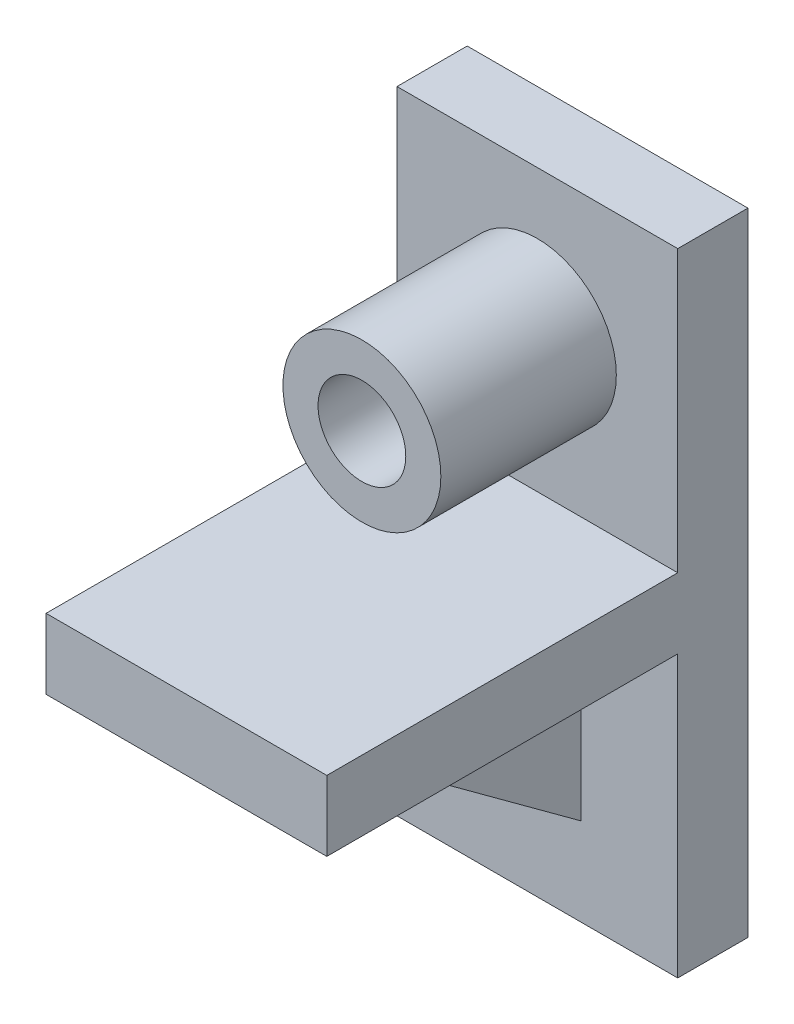
from build123d import *

# Parameters (mm, degrees)
SKETCH2_W           = 32
SKETCH2_H           = 72
BOSS_EXTRUDE1_DEPTH = 8
SKETCH3_R           = 9
SKETCH3_R_2         = 5
SKETCH3_W           = 32
SKETCH3_H           = 8
BOSS_EXTRUDE2_DEPTH = 20
SKETCH4_W           = 32
SKETCH4_H           = 8
BOSS_EXTRUDE3_DEPTH = 20
RIB1_REACH          = 80.09
SKETCH5_WALL_W      = 195.381659614
SKETCH5_WALL_H      = 10


with BuildPart() as part:
    # Sketch2 → Boss-Extrude1 (new body)
    with BuildSketch(Plane.XY):
        with Locations((-4.753138075, -23.481171548)):
            Rectangle(SKETCH2_W, SKETCH2_H)
    extrude(amount=BOSS_EXTRUDE1_DEPTH)

    # Sketch3 → Boss-Extrude2 (add)
    # profile 1 of 2: a face of its own
    with BuildSketch(Plane.XY.offset(8)):
        with Locations((-4.753138075, -3.481171548)):
            Circle(SKETCH3_R)
        with Locations((-4.753138075, -3.481171548)):
            Circle(SKETCH3_R_2, mode=Mode.SUBTRACT)
    # profile 2 of 2: a face of its own
    with BuildSketch(Plane.XY.offset(8)):
        with Locations((-4.753138075, -23.481171548)):
            Rectangle(SKETCH3_W, SKETCH3_H)
    extrude(amount=BOSS_EXTRUDE2_DEPTH)

    # Sketch4 → Boss-Extrude3 (add)
    with BuildSketch(Plane.XY.offset(28)):
        with Locations((-4.753138075, -23.481171548)):
            Rectangle(SKETCH4_W, SKETCH4_H)
    extrude(amount=BOSS_EXTRUDE3_DEPTH)

    # Sketch5 wall → Rib1 (add, up to next)
    with BuildSketch(Plane(origin=(-4.753138075, -38.481171548, 23), x_dir=(0, -0.591363663628, -0.806404995856), z_dir=(0, -0.806404995856, 0.591363663628)), mode=Mode.PRIVATE) as rib1_sk1:
        Rectangle(SKETCH5_WALL_W, SKETCH5_WALL_H)
    rib1_tool1 = extrude(rib1_sk1.sketch, amount=-RIB1_REACH, mode=Mode.PRIVATE) - part.part
    add(rib1_tool1.solids().sort_by_distance((-4.753138075, -38.481171548, 23))[0])


solid = part.part
